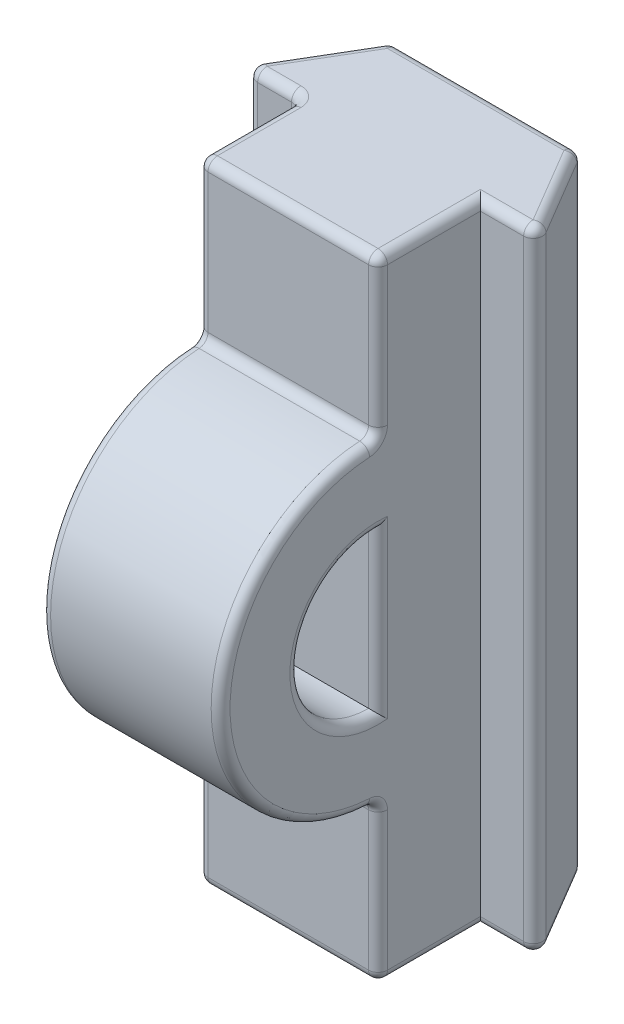
from build123d import *

# Parameters (mm, degrees)
BOSS_EXTRUDE1_DEPTH = 20
BOSS_EXTRUDE2_DEPTH = 2.85
FILLET1_R           = 0.3


with BuildPart() as part:
    # Sketch1 → Boss-Extrude1 (new body)
    with BuildSketch(Plane(origin=(0, 0, 0), x_dir=(1, 0, 0), z_dir=(0, 1, 0))):
        Polygon((-2.85, 0), (2.85, 0), (2.85, 3.25), (4.75, 3.25), (2.975, 6.25), (-2.975, 6.25), (-4.75, 3.25), (-2.85, 3.25), align=None)
    extrude(amount=BOSS_EXTRUDE1_DEPTH)

    # Sketch3 → Boss-Extrude2 (add, symmetric)
    with BuildSketch(Plane(origin=(0, 0, 0), x_dir=(0, 0, -1), z_dir=(1, 0, 0))):
        with BuildLine():
            ThreePointArc((0, 7.5), (-2.5, 10), (0, 12.5))
            Line((0, 12.5), (0, 15))
            ThreePointArc((0, 15), (-5, 10), (0, 5))
            Line((0, 5), (0, 7.5))
        make_face()
    extrude(amount=BOSS_EXTRUDE2_DEPTH, both=True)

    # Fillet1
    fillet1_edges = [part.edges().sort_by_distance(p)[0] for p in [
        (0, 0, -6.25),
        (3.8625, 0, -4.75),
        (3.8, 0, -3.25),
        (2.85, 0, -1.625),
        (3.8625, 20, -4.75),
        (2.85, 17.5, 0),
        (-2.85, 17.5, 0),
        (-2.85, 10, -3.25),
        (-4.75, 10, -3.25),
        (-2.975, 10, -6.25),
        (2.975, 10, -6.25),
        (4.75, 10, -3.25),
        (0, 20, -6.25),
        (-3.8625, 20, -4.75),
        (2.85, 10, 0),
        (-3.8, 20, -3.25),
        (2.85, 2.5, 0),
        (-2.85, 10, 0),
        (-2.85, 2.5, 0),
        (2.85, 10, 2.5),
        (-2.85, 20, -1.625),
        (-2.85, 10, 5),
        (0, 15, 0),
        (0, 5, 0),
        (2.85, 10, 5),
        (-2.85, 10, 2.5),
        (0, 20, 0),
        (2.85, 20, -1.625),
        (0, 0, 0),
        (3.8, 20, -3.25),
        (-2.85, 0, -1.625),
        (-3.8, 0, -3.25),
        (-3.8625, 0, -4.75),
    ]]
    fillet(fillet1_edges, radius=FILLET1_R)


solid = part.part
